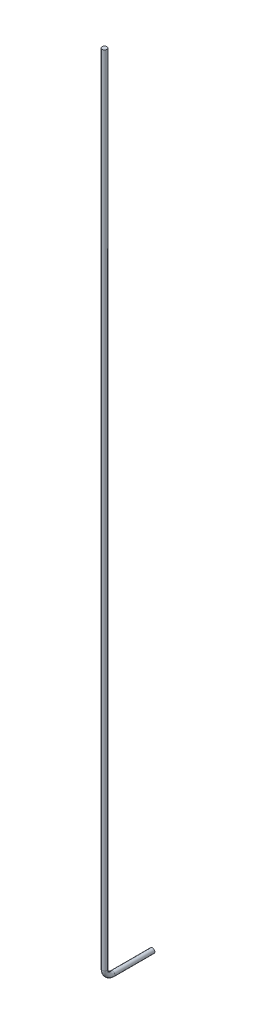
from build123d import *

# Parameters (mm, degrees)
SKETCH_1_R      = 1.5
EXTRUDE_1_DEPTH = 20
SKETCH_2_R      = 1.5


with BuildPart() as part:
    # ｽｹｯﾁ1 → ﾎﾞｽ - 押し出し1 (new body)
    with BuildSketch(Plane.XY):
        Circle(SKETCH_1_R)
    extrude(amount=EXTRUDE_1_DEPTH)

    # ｽｲｰﾌﾟ1: sweep along a path in ｽｹｯﾁ3
    with BuildLine(Plane(origin=(0, 0, 0), x_dir=(0, 0, -1), z_dir=(1, 0, 0))) as sweep_1_path:
        Line((-20, 0), (-25, 0))
        ThreePointArc((-25, 0), (-28.535533906, 1.464466094), (-30, 5))
        Line((-30, 5), (-30, 505))
    # ｽｹｯﾁ2 → ｽｲｰﾌﾟ1 (sweep)
    with BuildSketch(Plane.XY.offset(20)):
        Circle(SKETCH_2_R)
    sweep(path=sweep_1_path.line)


solid = part.part
